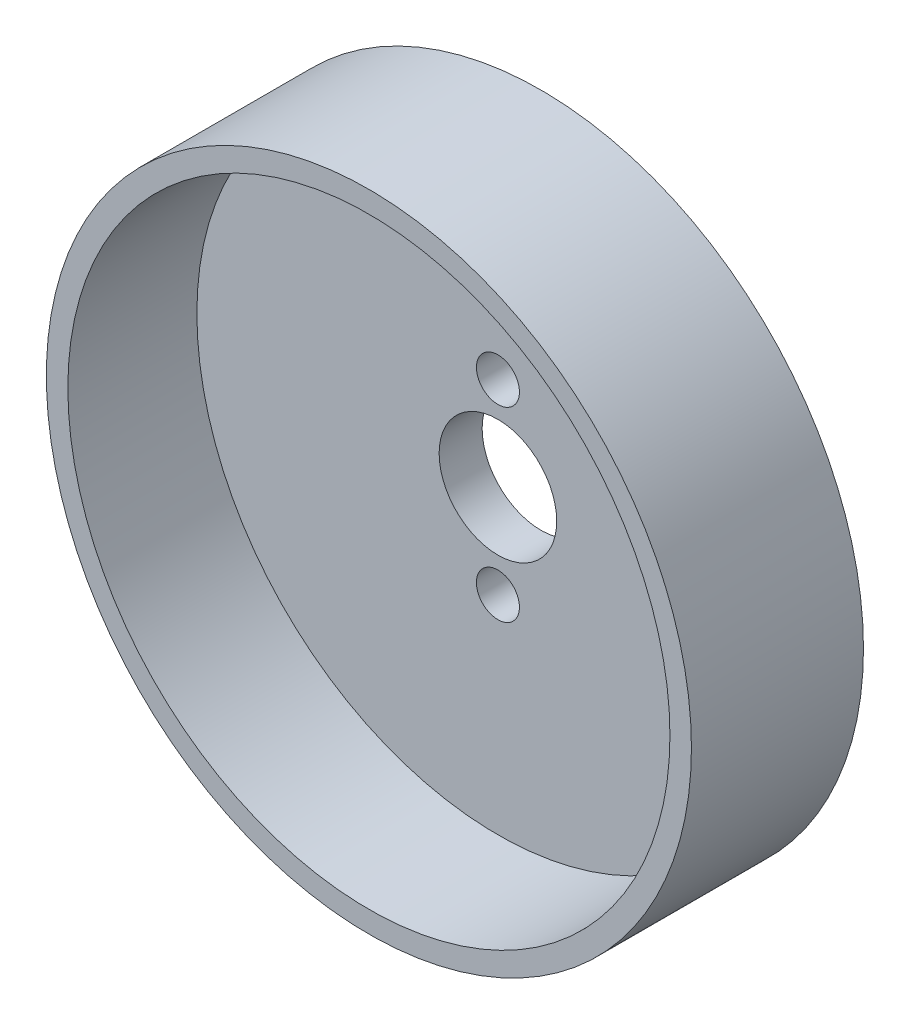
from build123d import *

# Parameters (mm, degrees)
SKETCH_1_R          = 22.5
EXTRUDE_1_DEPTH     = 3
SKETCH_2_R          = 22.5
SKETCH_2_R_2        = 21
EXTRUDE_2_DEPTH     = 9
SKETCH_4_R          = 4.1
SKETCH_4_R_2        = 1.5
CUT_EXTRUDE_1_DEPTH = 35.007352146


with BuildPart() as part:
    # 草图1 → 凸台-拉伸1 (new body)
    with BuildSketch(Plane.XY):
        Circle(SKETCH_1_R)
    extrude(amount=EXTRUDE_1_DEPTH)

    # 草图2 → 凸台-拉伸2 (add)
    with BuildSketch(Plane.XY.offset(3)):
        Circle(SKETCH_2_R)
        Circle(SKETCH_2_R_2, mode=Mode.SUBTRACT)
    extrude(amount=EXTRUDE_2_DEPTH)

    # 草图4 → 切除-拉伸1 (cut, through all)
    with BuildSketch(Plane(origin=(0, 0, 0), x_dir=(-1, 0, 0), z_dir=(0, 0, -1))):
        Circle(SKETCH_4_R)
        with Locations((0, 6.5)):
            Circle(SKETCH_4_R_2)
        with Locations((0, -6.5)):
            Circle(SKETCH_4_R_2)
    extrude(amount=-CUT_EXTRUDE_1_DEPTH, mode=Mode.SUBTRACT)


solid = part.part
